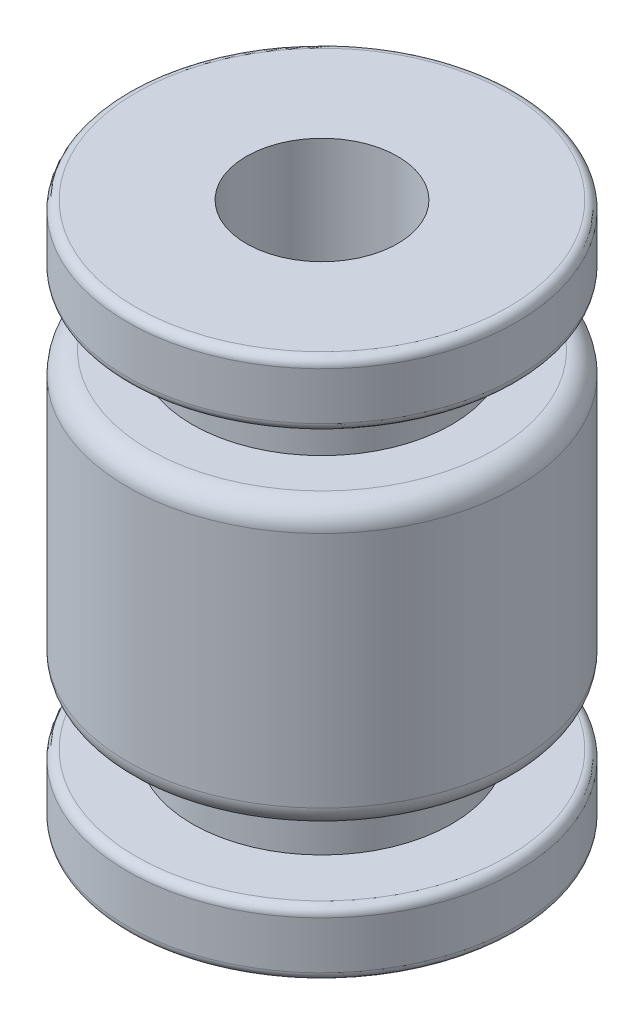
from build123d import *

# Parameters (mm, degrees)
FILLET1_R = 0.5
FILLET2_R = 0.2


with BuildPart() as part:
    # Sketch1 → Revolve1 (revolve)
    with BuildSketch(Plane.XY, mode=Mode.PRIVATE) as revolve1_sk:
        Polygon((1.75, 6.25), (1.75, -6.25), (4.5, -6.25), (4.5, -4.75), (3, -4.75), (3, -3.25), (4.5, -3.25), (4.5, 3.25), (3, 3.25), (3, 4.75), (4.5, 4.75), (4.5, 6.25), align=None)
    revolve(revolve1_sk.sketch.rotate(Axis((0, 6.25, 0), (0, -1, 0)), 180), axis=Axis((0, 6.25, 0), (0, -1, 0)))

    # Fillet1
    fillet1_edges = [part.edges().sort_by_distance(p)[0] for p in [
        (4.5, 3.25, 0),
        (4.5, -3.25, 0),
    ]]
    fillet(fillet1_edges, radius=FILLET1_R)

    # Fillet2
    fillet2_edges = [part.edges().sort_by_distance(p)[0] for p in [
        (4.5, -4.75, 0),
        (4.5, -6.25, 0),
        (4.5, 6.25, 0),
        (4.5, 4.75, 0),
    ]]
    fillet(fillet2_edges, radius=FILLET2_R)


solid = part.part
